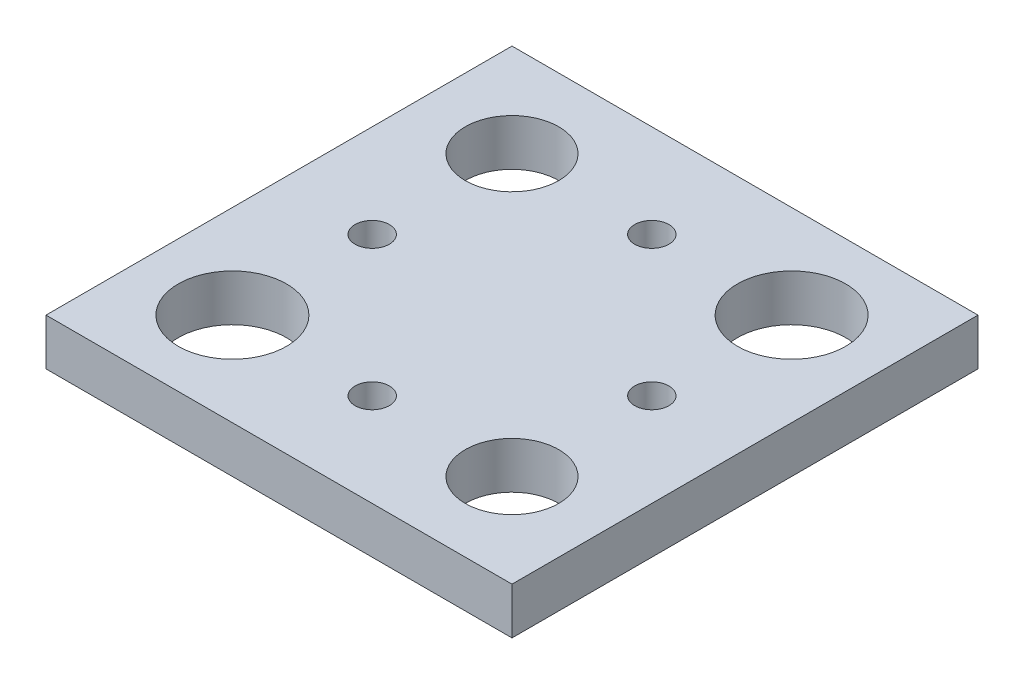
from build123d import *

# Parameters (mm, degrees)
SKETCH1_W               = 100
SKETCH1_H               = 100
BOSS_EXTRUDE1_DEPTH     = 10
CUT_EXTRUDE3_DEPTH      = 72.414284285
CUT_EXTRUDE3_DEPTH_BACK = 72.414284285
SKETCH3_R               = 10.025
SKETCH3_R_2             = 3.675
SKETCH3_R_3             = 11.6125


with BuildPart() as part:
    # Sketch1 → Boss-Extrude1 (new body)
    with BuildSketch(Plane(origin=(0, 0, 0), x_dir=(1, 0, 0), z_dir=(0, 1, 0))):
        Rectangle(SKETCH1_W, SKETCH1_H)
    extrude(amount=BOSS_EXTRUDE1_DEPTH)

    # Sketch3 → Cut-Extrude3 (cut, two sides: drawn at the far end of the back side and taken through both)
    with BuildSketch(Plane(origin=(0, 0, 0), x_dir=(1, 0, 0), z_dir=(0, 1, 0)).offset(-CUT_EXTRUDE3_DEPTH_BACK)):
        with Locations(Location((-30, 30, 0), (0, 0, 270))):
            Circle(SKETCH3_R)
        with Locations(Location((30, -30, 0), (0, 0, 270))):
            Circle(SKETCH3_R)
        with Locations(Location((0, 30, 0), (0, 0, 270))):
            Circle(SKETCH3_R_2)
        with Locations(Location((30, 0, 0), (0, 0, 270))):
            Circle(SKETCH3_R_2)
        with Locations(Location((0, -30, 0), (0, 0, 270))):
            Circle(SKETCH3_R_2)
        with Locations(Location((-30, 0, 0), (0, 0, 270))):
            Circle(SKETCH3_R_2)
        with Locations(Location((30, 30, 0), (0, 0, 270))):
            Circle(SKETCH3_R_3)
        with Locations(Location((-30, -30, 0), (0, 0, 270))):
            Circle(SKETCH3_R_3)
    extrude(amount=CUT_EXTRUDE3_DEPTH + CUT_EXTRUDE3_DEPTH_BACK, mode=Mode.SUBTRACT)


solid = part.part
